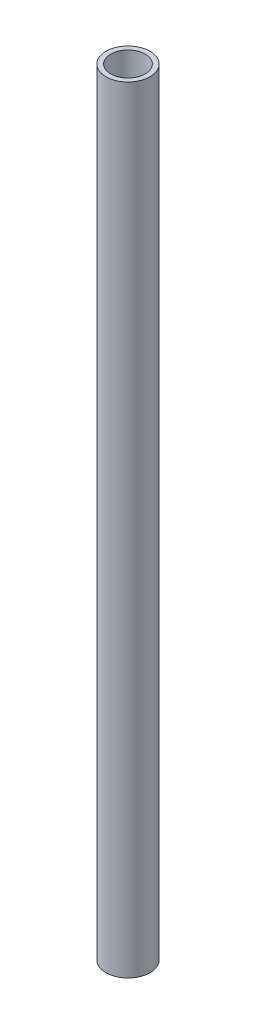
from build123d import *

# Parameters (mm, degrees)
SKETCH1_R           = 7.9375
SKETCH1_R_2         = 6.2103
BOSS_EXTRUDE1_DEPTH = 279.4


with BuildPart() as part:
    # Sketch1 → Boss-Extrude1 (new body)
    with BuildSketch(Plane(origin=(0, 0, 0), x_dir=(1, 0, 0), z_dir=(0, 1, 0))):
        with Locations(Location((0, 0, 0), (0, 0, 270))):
            Circle(SKETCH1_R)
        with Locations(Location((0, 0, 0), (0, 0, 270))):
            Circle(SKETCH1_R_2, mode=Mode.SUBTRACT)
    extrude(amount=BOSS_EXTRUDE1_DEPTH)


solid = part.part
